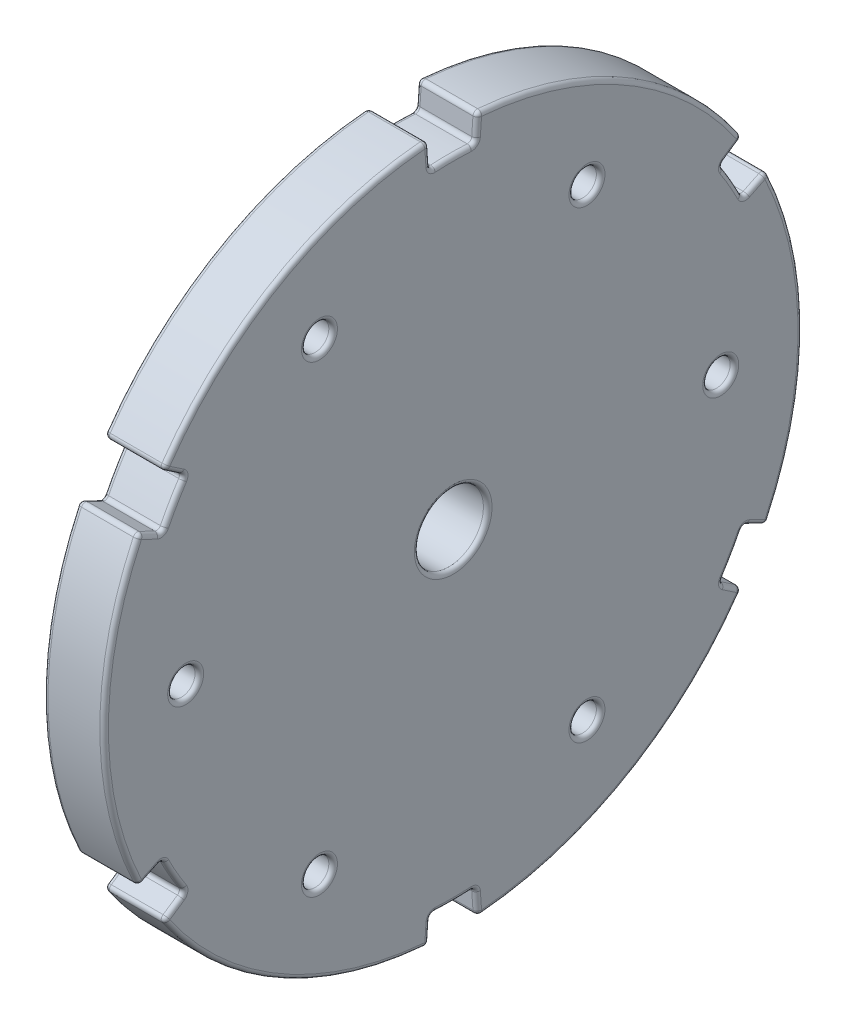
from build123d import *

# Parameters (mm, degrees)
SKETCH1_W          = 7
SKETCH1_H          = 40.45
CUT_EXTRUDE1_REACH = 59.632
SKETCH2_R          = 1.5875
SKETCH3_R          = 2.325
CUT_EXTRUDE2_DEPTH = 2.8575
CIRPATTERN1_COUNT  = 6
CUT_EXTRUDE3_REACH = 59.632
SKETCH4_R          = 4
CUT_EXTRUDE4_REACH = 59.632
CIRPATTERN2_COUNT  = 6
FILLET1_R          = 0.5


with BuildPart() as part:
    # Sketch1 → Revolve1 (revolve)
    with BuildSketch(Plane.XY, mode=Mode.PRIVATE) as revolve1_sk:
        with Locations((3.5, 20.225)):
            Rectangle(SKETCH1_W, SKETCH1_H)
    revolve(revolve1_sk.sketch.rotate(Axis((0, 0, 0), (1, 0, 0)), 90), axis=Axis((0, 0, 0), (1, 0, 0)))

    # Sketch2 → Cut-Extrude1 (cut, up to next)
    with BuildSketch(Plane(origin=(7, 0, 0), x_dir=(0, 0, -1), z_dir=(1, 0, 0)), mode=Mode.PRIVATE) as cut_extrude1_sk1:
        with Locations((-31, 0)):
            Circle(SKETCH2_R)
    cut_extrude1_tool1 = extrude(cut_extrude1_sk1.sketch, amount=-CUT_EXTRUDE1_REACH, mode=Mode.PRIVATE) & part.part
    # Sketch2 → Cut-Extrude1 (cut, up to next)
    with BuildSketch(Plane(origin=(7, 0, 0), x_dir=(0, 0, -1), z_dir=(1, 0, 0)), mode=Mode.PRIVATE) as cut_extrude1_sk2:
        with Locations((-15.5, 26.846787517)):
            Circle(SKETCH2_R)
    cut_extrude1_tool2 = extrude(cut_extrude1_sk2.sketch, amount=-CUT_EXTRUDE1_REACH, mode=Mode.PRIVATE) & part.part
    # Sketch2 → Cut-Extrude1 (cut, up to next)
    with BuildSketch(Plane(origin=(7, 0, 0), x_dir=(0, 0, -1), z_dir=(1, 0, 0)), mode=Mode.PRIVATE) as cut_extrude1_sk3:
        with Locations((15.5, 26.846787517)):
            Circle(SKETCH2_R)
    cut_extrude1_tool3 = extrude(cut_extrude1_sk3.sketch, amount=-CUT_EXTRUDE1_REACH, mode=Mode.PRIVATE) & part.part
    # Sketch2 → Cut-Extrude1 (cut, up to next)
    with BuildSketch(Plane(origin=(7, 0, 0), x_dir=(0, 0, -1), z_dir=(1, 0, 0)), mode=Mode.PRIVATE) as cut_extrude1_sk4:
        with Locations((31, 0)):
            Circle(SKETCH2_R)
    cut_extrude1_tool4 = extrude(cut_extrude1_sk4.sketch, amount=-CUT_EXTRUDE1_REACH, mode=Mode.PRIVATE) & part.part
    # Sketch2 → Cut-Extrude1 (cut, up to next)
    with BuildSketch(Plane(origin=(7, 0, 0), x_dir=(0, 0, -1), z_dir=(1, 0, 0)), mode=Mode.PRIVATE) as cut_extrude1_sk5:
        with Locations((15.5, -26.846787517)):
            Circle(SKETCH2_R)
    cut_extrude1_tool5 = extrude(cut_extrude1_sk5.sketch, amount=-CUT_EXTRUDE1_REACH, mode=Mode.PRIVATE) & part.part
    # Sketch2 → Cut-Extrude1 (cut, up to next)
    with BuildSketch(Plane(origin=(7, 0, 0), x_dir=(0, 0, -1), z_dir=(1, 0, 0)), mode=Mode.PRIVATE) as cut_extrude1_sk6:
        with Locations((-15.5, -26.846787517)):
            Circle(SKETCH2_R)
    cut_extrude1_tool6 = extrude(cut_extrude1_sk6.sketch, amount=-CUT_EXTRUDE1_REACH, mode=Mode.PRIVATE) & part.part
    add(cut_extrude1_tool1.solids().sort_by_distance((7, 0, 31))[0], mode=Mode.SUBTRACT)
    add(cut_extrude1_tool2.solids().sort_by_distance((7, 26.846788, 15.5))[0], mode=Mode.SUBTRACT)
    add(cut_extrude1_tool3.solids().sort_by_distance((7, 26.846788, -15.5))[0], mode=Mode.SUBTRACT)
    add(cut_extrude1_tool4.solids().sort_by_distance((7, 0, -31))[0], mode=Mode.SUBTRACT)
    add(cut_extrude1_tool5.solids().sort_by_distance((7, -26.846788, -15.5))[0], mode=Mode.SUBTRACT)
    add(cut_extrude1_tool6.solids().sort_by_distance((7, -26.846788, 15.5))[0], mode=Mode.SUBTRACT)

    # Sketch3 → Cut-Extrude2 (cut)
    with BuildSketch(Plane(origin=(0, 0, 0), x_dir=(0, 0, -1), z_dir=(1, 0, 0))):
        with Locations((15.5, 26.846787517)):
            Circle(SKETCH3_R)
    cut_extrude2 = extrude(amount=CUT_EXTRUDE2_DEPTH, mode=Mode.SUBTRACT)

    # CirPattern1: Cut-Extrude2 ×6 about axis
    cirpattern1_axis = Axis((0, 0, 0), (1, 0, 0))
    for i in range(1, CIRPATTERN1_COUNT):
        add(cut_extrude2.rotate(cirpattern1_axis, i * 360 / CIRPATTERN1_COUNT), mode=Mode.SUBTRACT)

    # Sketch4 → Cut-Extrude3 (cut, up to next)
    with BuildSketch(Plane(origin=(7, 0, 0), x_dir=(0, 0, -1), z_dir=(1, 0, 0)), mode=Mode.PRIVATE) as cut_extrude3_sk1:
        Circle(SKETCH4_R)
    cut_extrude3_tool1 = extrude(cut_extrude3_sk1.sketch, amount=-CUT_EXTRUDE3_REACH, mode=Mode.PRIVATE) & part.part
    add(cut_extrude3_tool1.solids().sort_by_distance((7, 0, 0))[0], mode=Mode.SUBTRACT)

    # Sketch5 → Cut-Extrude4 (cut, up to next)
    with BuildSketch(Plane(origin=(7, 0, 0), x_dir=(0, 0, -1), z_dir=(1, 0, 0)), mode=Mode.PRIVATE) as cut_extrude4_sk1:
        with BuildLine():
            Line((-2.821649363, 40.351465833), (-2.611868927, 37.351465833))
            ThreePointArc((-2.611868927, 37.351465833), (0, 37.442674306), (2.611868927, 37.351465833))
            Line((2.611868927, 37.351465833), (2.821649363, 40.351465833))
            ThreePointArc((2.821649363, 40.351465833), (0, 40.45), (-2.821649363, 40.351465833))
        make_face()
    cut_extrude4_tool1 = extrude(cut_extrude4_sk1.sketch, amount=-CUT_EXTRUDE4_REACH, mode=Mode.PRIVATE) & part.part
    cut_extrude4 = cut_extrude4_tool1.solids().sort_by_distance((7, 38.934044, 0))[0]
    add(cut_extrude4, mode=Mode.SUBTRACT)

    # CirPattern2: Cut-Extrude4 ×6 about axis
    cirpattern2_axis = Axis((0, 0, 0), (1, 0, 0))
    for i in range(1, CIRPATTERN2_COUNT):
        add(cut_extrude4.rotate(cirpattern2_axis, i * 360 / CIRPATTERN2_COUNT), mode=Mode.SUBTRACT)

    # Fillet1
    fillet1_edges = [part.edges().sort_by_distance(p)[0] for p in [
        (0, 0, -40.45),
        (0, -35.030727583, -20.225),
        (0, -35.030727583, 20.225),
        (0, 0, 40.45),
        (0, 35.030727583, 20.225),
        (3.5, 17.732112888, 36.356219173),
        (3.5, 22.619352945, 33.53456981),
        (3.5, 20.937677759, 31.041383816),
        (3.5, 16.413788074, 33.653252744),
        (7, 17.072950481, 35.004735958),
        (7, 18.721337153, 32.426307134),
        (7, 21.778515352, 32.287976813),
        (0, 21.778515352, 32.287976813),
        (0, 18.721337153, 32.426307134),
        (0, 17.072950481, 35.004735958),
        (3.5, -22.619352945, 33.53456981),
        (3.5, -17.732112888, 36.356219173),
        (3.5, -16.413788074, 33.653252744),
        (3.5, -20.937677759, 31.041383816),
        (7, -21.778515352, 32.287976813),
        (7, -18.721337153, 32.426307134),
        (7, -17.072950481, 35.004735958),
        (0, -17.072950481, 35.004735958),
        (0, -18.721337153, 32.426307134),
        (0, -21.778515352, 32.287976813),
        (3.5, -40.351465833, -2.821649363),
        (3.5, -40.351465833, 2.821649363),
        (3.5, -37.351465833, 2.611868927),
        (3.5, -37.351465833, -2.611868927),
        (7, -38.851465833, -2.716759145),
        (7, -37.442674306, 0),
        (7, -38.851465833, 2.716759145),
        (0, -38.851465833, 2.716759145),
        (0, -37.442674306, 0),
        (0, -38.851465833, -2.716759145),
        (3.5, -17.732112888, -36.356219173),
        (3.5, -22.619352945, -33.53456981),
        (3.5, -20.937677759, -31.041383816),
        (3.5, -16.413788074, -33.653252744),
        (7, -17.072950481, -35.004735958),
        (7, -18.721337153, -32.426307134),
        (7, -21.778515352, -32.287976813),
        (0, -21.778515352, -32.287976813),
        (0, -18.721337153, -32.426307134),
        (0, -17.072950481, -35.004735958),
        (3.5, 22.619352945, -33.53456981),
        (3.5, 17.732112888, -36.356219173),
        (3.5, 16.413788074, -33.653252744),
        (3.5, 20.937677759, -31.041383816),
        (7, 21.778515352, -32.287976813),
        (7, 18.721337153, -32.426307134),
        (7, 17.072950481, -35.004735958),
        (0, 17.072950481, -35.004735958),
        (0, 18.721337153, -32.426307134),
        (0, 21.778515352, -32.287976813),
        (7, 0, 32.5875),
        (7, -26.846787517, 17.0875),
        (7, -26.846787517, -13.9125),
        (7, 0, -29.4125),
        (7, 26.846787517, -13.9125),
        (7, 26.846787517, 17.0875),
        (2.8575, 26.846787517, -13.9125),
        (0, 26.846787517, -13.175),
        (2.8575, 0, -29.4125),
        (0, 2.013509064, -29.8375),
        (2.8575, -26.846787517, -13.9125),
        (0, -24.833278454, -16.6625),
        (2.8575, -26.846787517, 17.0875),
        (0, -26.846787517, 13.175),
        (2.8575, 0, 32.5875),
        (0, -2.013509064, 29.8375),
        (2.8575, 26.846787517, 17.0875),
        (0, 24.833278454, 16.6625),
        (7, 0, 4),
        (0, 0, 4),
        (7, 35.030727583, -20.225),
        (0, 35.030727583, -20.225),
        (3.5, 40.351465833, 2.821649363),
        (3.5, 40.351465833, -2.821649363),
        (3.5, 37.351465833, -2.611868927),
        (3.5, 37.351465833, 2.611868927),
        (7, 38.851465833, 2.716759145),
        (7, 37.442674306, 0),
        (7, 38.851465833, -2.716759145),
        (0, 38.851465833, -2.716759145),
        (0, 37.442674306, 0),
        (0, 38.851465833, 2.716759145),
        (7, 0, -40.45),
        (7, -35.030727583, -20.225),
        (7, -35.030727583, 20.225),
        (7, 0, 40.45),
        (7, 35.030727583, 20.225),
    ]]
    fillet(fillet1_edges, radius=FILLET1_R)


solid = part.part
